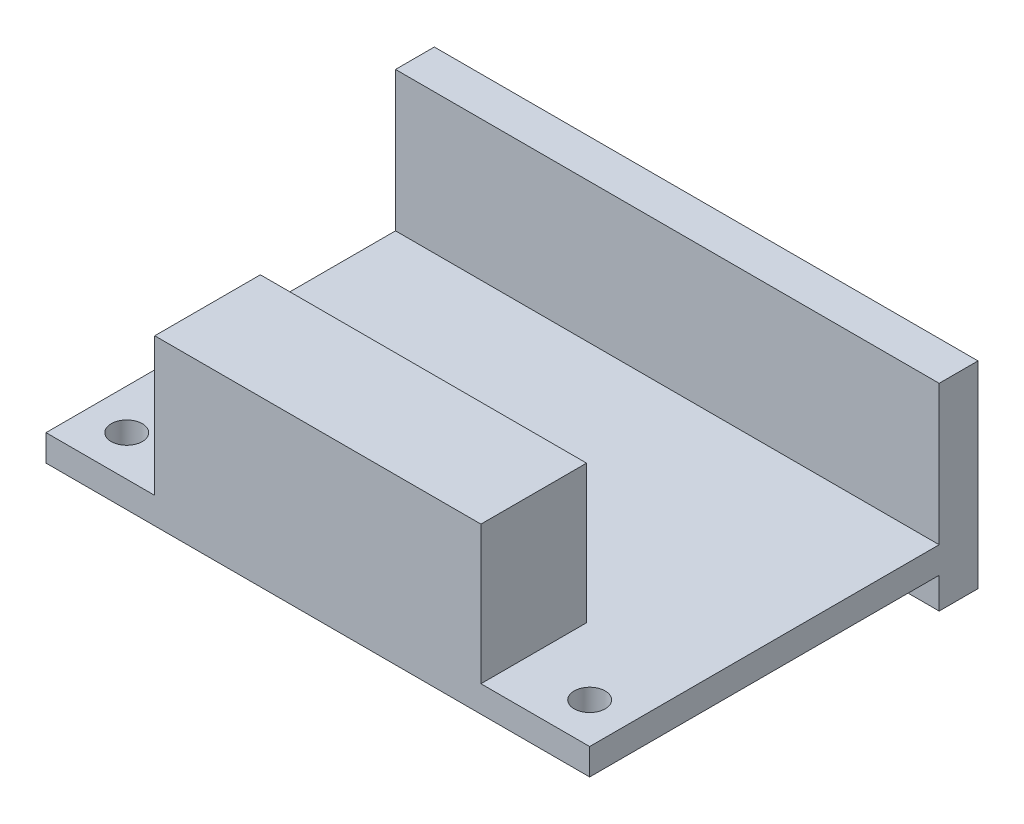
from build123d import *

# Parameters (mm, degrees)
SKETCH1_W           = 35
SKETCH1_H           = 25
BOSS_EXTRUDE1_DEPTH = 1.7
SKETCH2_W           = 21
SKETCH2_H           = 6.8
BOSS_EXTRUDE2_DEPTH = 8.9
SKETCH3_W           = 35
SKETCH3_H           = 2.5
BOSS_EXTRUDE3_DEPTH = 9
SKETCH4_W           = 35
SKETCH4_H           = 2.5
SKETCH4_W_2         = 19.5
BOSS_EXTRUDE4_DEPTH = 2
CUT_EXTRUDE1_REACH  = 25.313
SKETCH5_R           = 1


with BuildPart() as part:
    # Sketch1 → Boss-Extrude1 (new body)
    with BuildSketch(Plane(origin=(0, 0, 0), x_dir=(1, 0, 0), z_dir=(0, 1, 0))):
        Rectangle(SKETCH1_W, SKETCH1_H)
    extrude(amount=BOSS_EXTRUDE1_DEPTH)

    # Sketch2 → Boss-Extrude2 (add)
    with BuildSketch(Plane(origin=(0, 1.7, 0), x_dir=(1, 0, 0), z_dir=(0, 1, 0))):
        with Locations((0, -9.1)):
            Rectangle(SKETCH2_W, SKETCH2_H)
    extrude(amount=BOSS_EXTRUDE2_DEPTH)

    # Sketch3 → Boss-Extrude3 (add)
    with BuildSketch(Plane(origin=(0, 1.7, 0), x_dir=(1, 0, 0), z_dir=(0, 1, 0))):
        with Locations((0, 11.25)):
            Rectangle(SKETCH3_W, SKETCH3_H)
    extrude(amount=BOSS_EXTRUDE3_DEPTH)

    # Sketch4 → Boss-Extrude4 (add)
    with BuildSketch(Plane.XZ):
        with Locations((0, -11.25)):
            Rectangle(SKETCH4_W, SKETCH4_H)
        with Locations((0, 8.25)):
            Rectangle(SKETCH4_W_2, SKETCH4_H)
    extrude(amount=BOSS_EXTRUDE4_DEPTH)

    # Sketch5 → Cut-Extrude1 (cut, up to next)
    with BuildSketch(Plane(origin=(0, 1.7, 0), x_dir=(1, 0, 0), z_dir=(0, 1, 0)), mode=Mode.PRIVATE) as cut_extrude1_sk1:
        with Locations(Location((14.9, -9.9, 0), (0, 0, 270))):
            Circle(SKETCH5_R)
    cut_extrude1_tool1 = extrude(cut_extrude1_sk1.sketch, amount=-CUT_EXTRUDE1_REACH, mode=Mode.PRIVATE) & part.part
    # Sketch5 → Cut-Extrude1 (cut, up to next)
    with BuildSketch(Plane(origin=(0, 1.7, 0), x_dir=(1, 0, 0), z_dir=(0, 1, 0)), mode=Mode.PRIVATE) as cut_extrude1_sk2:
        with Locations(Location((-14.9, -9.9, 0), (0, 0, 270))):
            Circle(SKETCH5_R)
    cut_extrude1_tool2 = extrude(cut_extrude1_sk2.sketch, amount=-CUT_EXTRUDE1_REACH, mode=Mode.PRIVATE) & part.part
    add(cut_extrude1_tool1.solids().sort_by_distance((14.9, 1.7, 9.9))[0], mode=Mode.SUBTRACT)
    add(cut_extrude1_tool2.solids().sort_by_distance((-14.9, 1.7, 9.9))[0], mode=Mode.SUBTRACT)


solid = part.part
